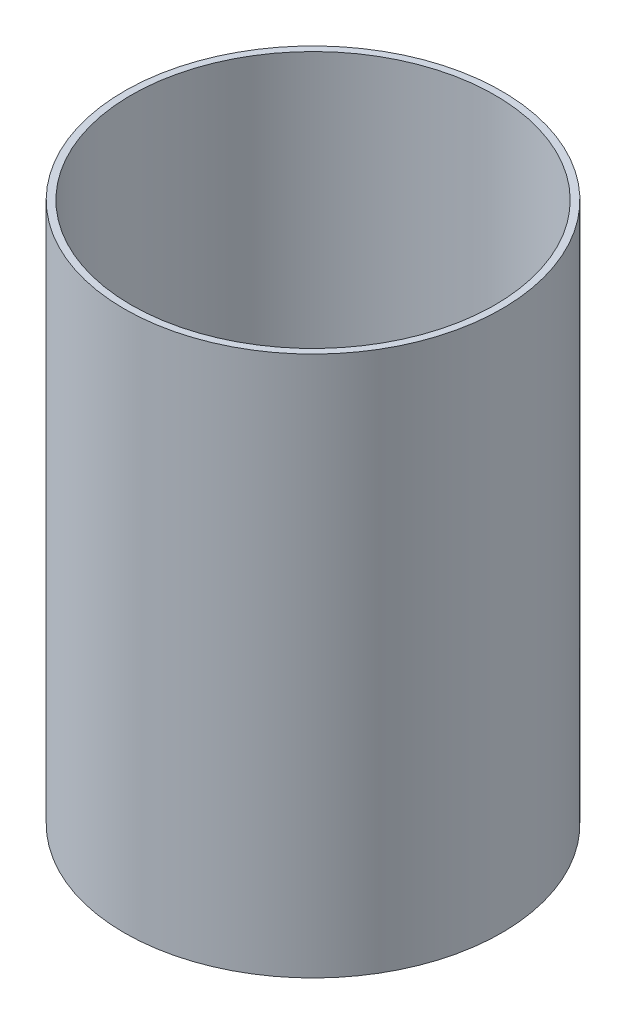
from build123d import *

# Parameters (mm, degrees)
SKETCH1_R           = 69.85
SKETCH1_R_2         = 67.31
BOSS_EXTRUDE1_DEPTH = 200


with BuildPart() as part:
    # Sketch1 → Boss-Extrude1 (new body)
    with BuildSketch(Plane(origin=(0, 0, 0), x_dir=(1, 0, 0), z_dir=(0, 1, 0))):
        with Locations(Location((0, 0, 0), (0, 0, 270))):
            Circle(SKETCH1_R)
        with Locations(Location((0, 0, 0), (0, 0, 270))):
            Circle(SKETCH1_R_2, mode=Mode.SUBTRACT)
    extrude(amount=BOSS_EXTRUDE1_DEPTH)


solid = part.part
